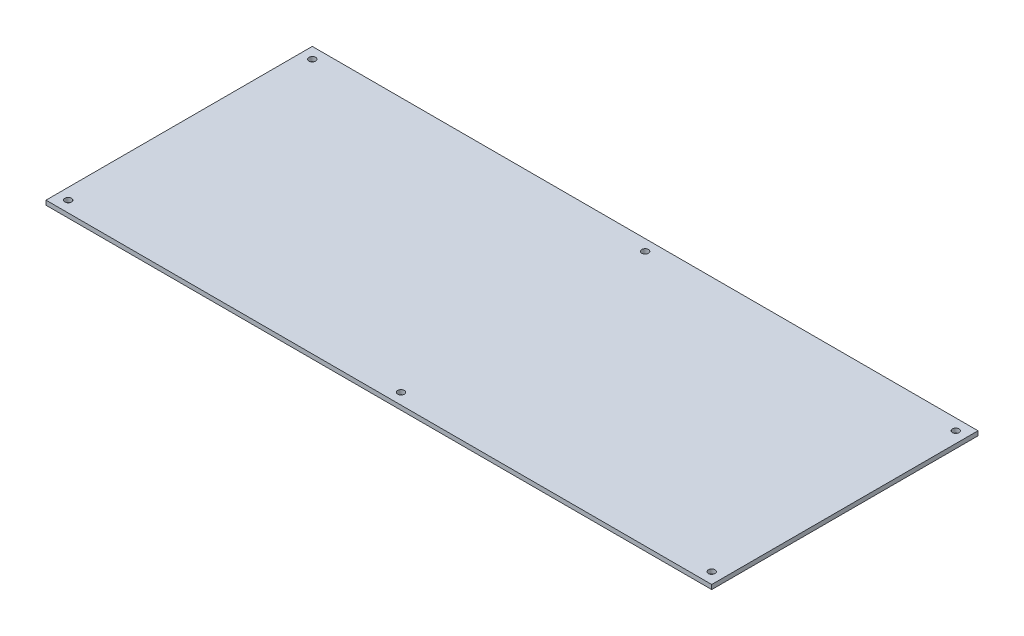
from build123d import *

# Parameters (mm, degrees)
SKETCH1_W           = 300
SKETCH1_H           = 120
SKETCH1_R           = 1.5
BOSS_EXTRUDE1_DEPTH = 2


with BuildPart() as part:
    # Sketch1 → Boss-Extrude1 (new body)
    with BuildSketch(Plane(origin=(0, 0, 0), x_dir=(1, 0, 0), z_dir=(0, 1, 0))):
        Rectangle(SKETCH1_W, SKETCH1_H)
        with Locations(Location((-145, 55, 0), (0, 0, 270))):
            Circle(SKETCH1_R, mode=Mode.SUBTRACT)
        with Locations(Location((145, 55, 0), (0, 0, 90))):
            Circle(SKETCH1_R, mode=Mode.SUBTRACT)
        with Locations(Location((-145, -55, 0), (0, 0, 90))):
            Circle(SKETCH1_R, mode=Mode.SUBTRACT)
        with Locations(Location((145, -55, 0), (0, 0, 270))):
            Circle(SKETCH1_R, mode=Mode.SUBTRACT)
        with Locations(Location((5, -55, 0), (0, 0, 270))):
            Circle(SKETCH1_R, mode=Mode.SUBTRACT)
        with Locations(Location((5, 55, 0), (0, 0, 90))):
            Circle(SKETCH1_R, mode=Mode.SUBTRACT)
    extrude(amount=BOSS_EXTRUDE1_DEPTH)


solid = part.part
